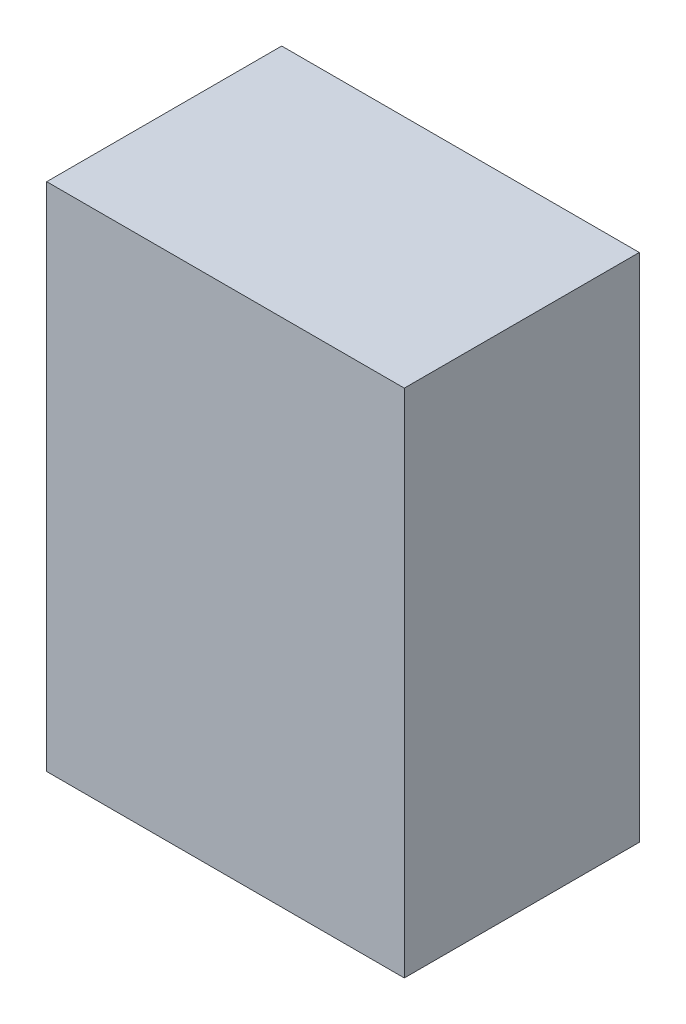
from build123d import *

# Parameters (mm, degrees)
SKETCH_1_W      = 35
SKETCH_1_H      = 50
EXTRUDE_1_DEPTH = 23


with BuildPart() as part:
    # ｽｹｯﾁ1 → ﾎﾞｽ - 押し出し1 (new body)
    with BuildSketch(Plane.XY):
        Rectangle(SKETCH_1_W, SKETCH_1_H)
    extrude(amount=EXTRUDE_1_DEPTH)


solid = part.part
